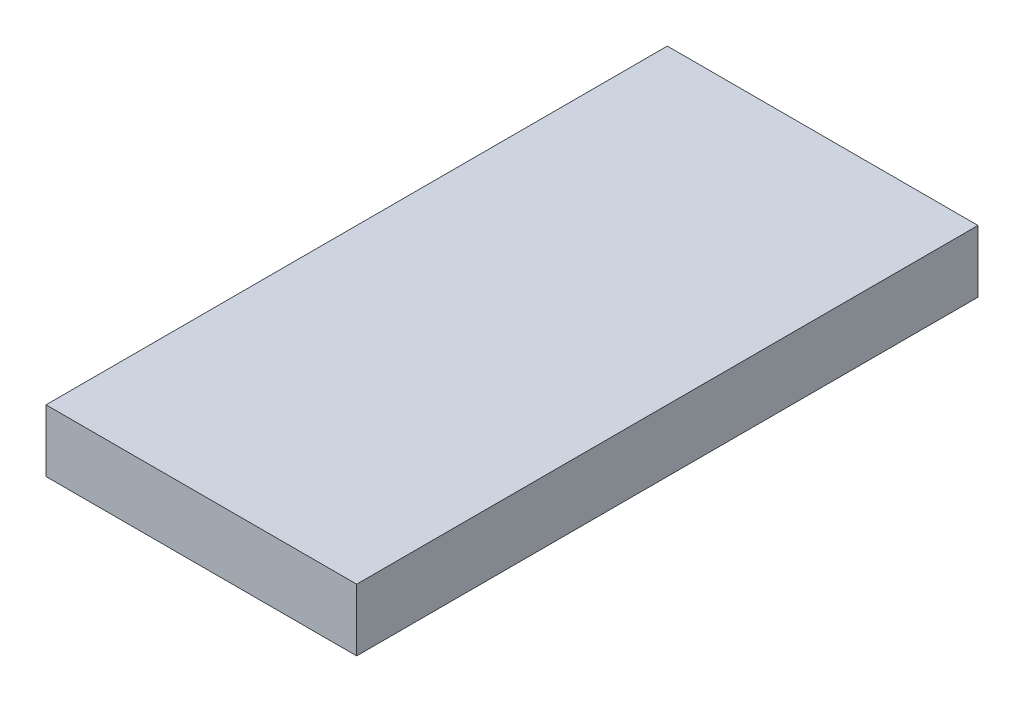
from build123d import *

# Parameters (mm, degrees)
SKETCH1_W           = 60
SKETCH1_H           = 120
BOSS_EXTRUDE1_DEPTH = 6


with BuildPart() as part:
    # Sketch1 → Boss-Extrude1 (new, symmetric)
    with BuildSketch(Plane(origin=(0, 0, 0), x_dir=(1, 0, 0), z_dir=(0, 1, 0))):
        with Locations((30, 60)):
            Rectangle(SKETCH1_W, SKETCH1_H)
    extrude(amount=BOSS_EXTRUDE1_DEPTH, both=True)


solid = part.part
